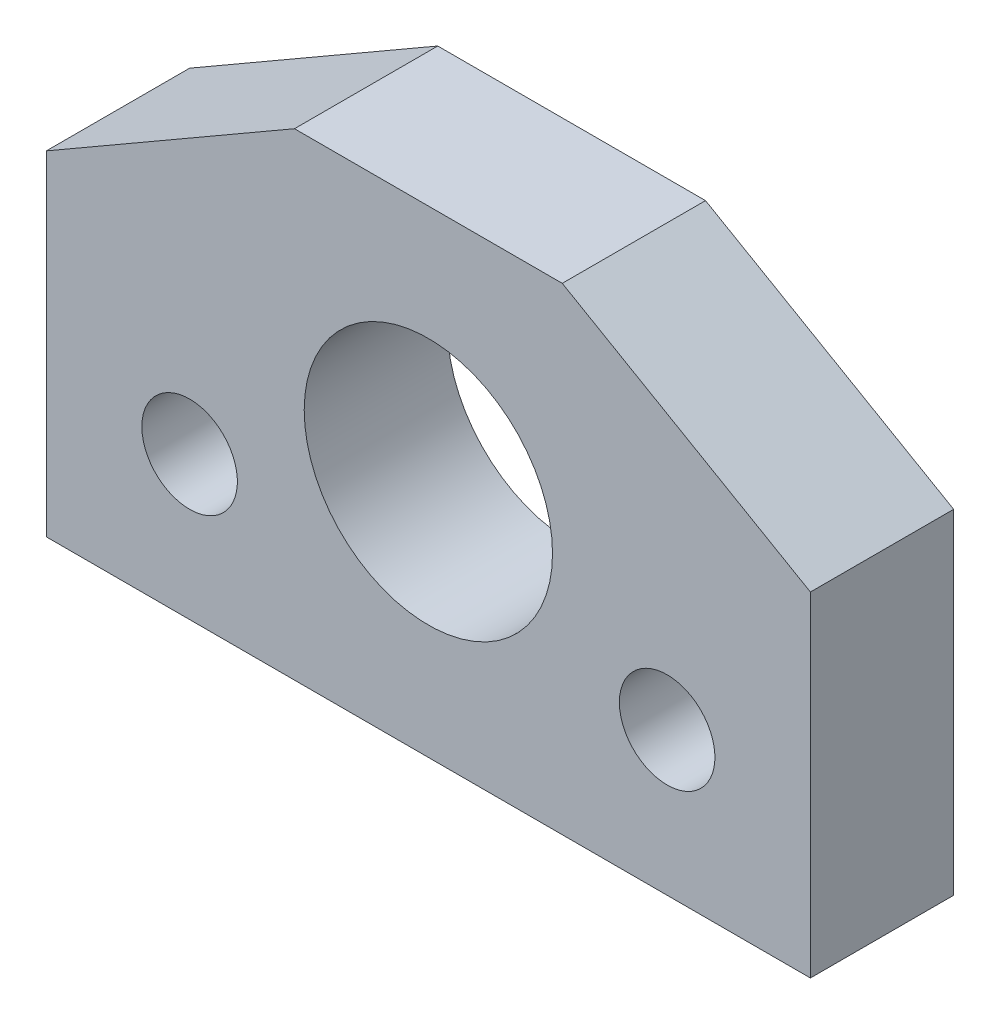
from build123d import *

# Parameters (mm, degrees)
BOSS_EXTRUDE1_DEPTH     = 19.05
CUT_EXTRUDE3_DEPTH      = 122.316579658
CUT_EXTRUDE3_DEPTH_BACK = 122.316579658
SKETCH2_R               = 6.35
SKETCH2_R_2             = 16.51


with BuildPart() as part:
    # Sketch1 → Boss-Extrude1 (new body)
    with BuildSketch(Plane.XY):
        Polygon((0, 0), (101.6, 0), (101.6, 44.45), (68.604432116, 63.5), (32.995567884, 63.5), (0, 44.45), align=None)
    extrude(amount=BOSS_EXTRUDE1_DEPTH)

    # Sketch2 → Cut-Extrude3 (cut, two sides: drawn at the far end of the back side and taken through both)
    with BuildSketch(Plane.XY.offset(-CUT_EXTRUDE3_DEPTH_BACK)):
        with Locations(Location((19.05, 19.05, 0), (0, 0, 180))):
            Circle(SKETCH2_R)
        with Locations(Location((82.55, 19.05, 0), (0, 0, 180))):
            Circle(SKETCH2_R)
        with Locations(Location((50.8, 31.75, 0), (0, 0, 180))):
            Circle(SKETCH2_R_2)
    extrude(amount=CUT_EXTRUDE3_DEPTH + CUT_EXTRUDE3_DEPTH_BACK, mode=Mode.SUBTRACT)


solid = part.part
